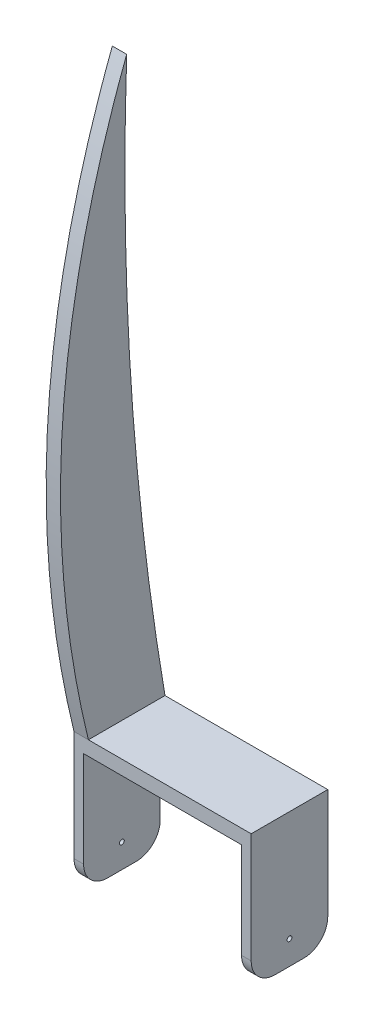
from build123d import *

# Parameters (mm, degrees)
SKETCH1_W               = 37
SKETCH1_H               = 16
BOSS_EXTRUDE1_DEPTH     = 3
SKETCH2_W               = 2
SKETCH2_H               = 16
BOSS_EXTRUDE2_DEPTH     = 25
FILLET1_R               = 5
CUT_EXTRUDE1_DEPTH      = 46.365184889
CUT_EXTRUDE1_DEPTH_BACK = 46.365184889
SKETCH3_R               = 0.5
BOSS_EXTRUDE3_DEPTH     = 3


with BuildPart() as part:
    # Sketch1 → Boss-Extrude1 (new body)
    with BuildSketch(Plane(origin=(0, 0, 0), x_dir=(1, 0, 0), z_dir=(0, 1, 0))):
        Rectangle(SKETCH1_W, SKETCH1_H)
    extrude(amount=BOSS_EXTRUDE1_DEPTH)

    # Sketch2 → Boss-Extrude2 (add)
    with BuildSketch(Plane.XZ):
        with Locations((17.5, 0)):
            Rectangle(SKETCH2_W, SKETCH2_H)
        with Locations((-17.5, 0)):
            Rectangle(SKETCH2_W, SKETCH2_H)
    extrude(amount=BOSS_EXTRUDE2_DEPTH)

    # Fillet1
    fillet1_edges = [part.edges().sort_by_distance(p)[0] for p in [
        (17.5, -25, 8),
        (17.5, -25, -8),
        (-17.5, -25, -8),
        (-17.5, -25, 8),
    ]]
    fillet(fillet1_edges, radius=FILLET1_R)

    # Sketch3 → Cut-Extrude1 (cut, two sides: drawn at the far end of the back side and taken through both)
    with BuildSketch(Plane(origin=(18.5, 0, 0), x_dir=(0, 0, -1), z_dir=(1, 0, 0)).offset(-CUT_EXTRUDE1_DEPTH_BACK)):
        with Locations((0, -20)):
            Circle(SKETCH3_R)
    extrude(amount=CUT_EXTRUDE1_DEPTH + CUT_EXTRUDE1_DEPTH_BACK, mode=Mode.SUBTRACT)

    # Sketch4 → Boss-Extrude3 (add)
    with BuildSketch(Plane.ZY.offset(18.5)):
        with BuildLine():
            Line((8, 3), (-8, 3))
            add(Edge.make_bspline(
                [(-8, 3), (2.138723357, 62.272306254), (0, 123)],
                knots=[0, 0, 0, 1, 1, 1], degree=2))
            add(Edge.make_bspline(
                [(8, 3), (22.794261884, 63.3166085), (0, 123)],
                knots=[0, 0, 0, 1, 1, 1], degree=2))
        make_face()
    extrude(amount=-BOSS_EXTRUDE3_DEPTH)


solid = part.part
